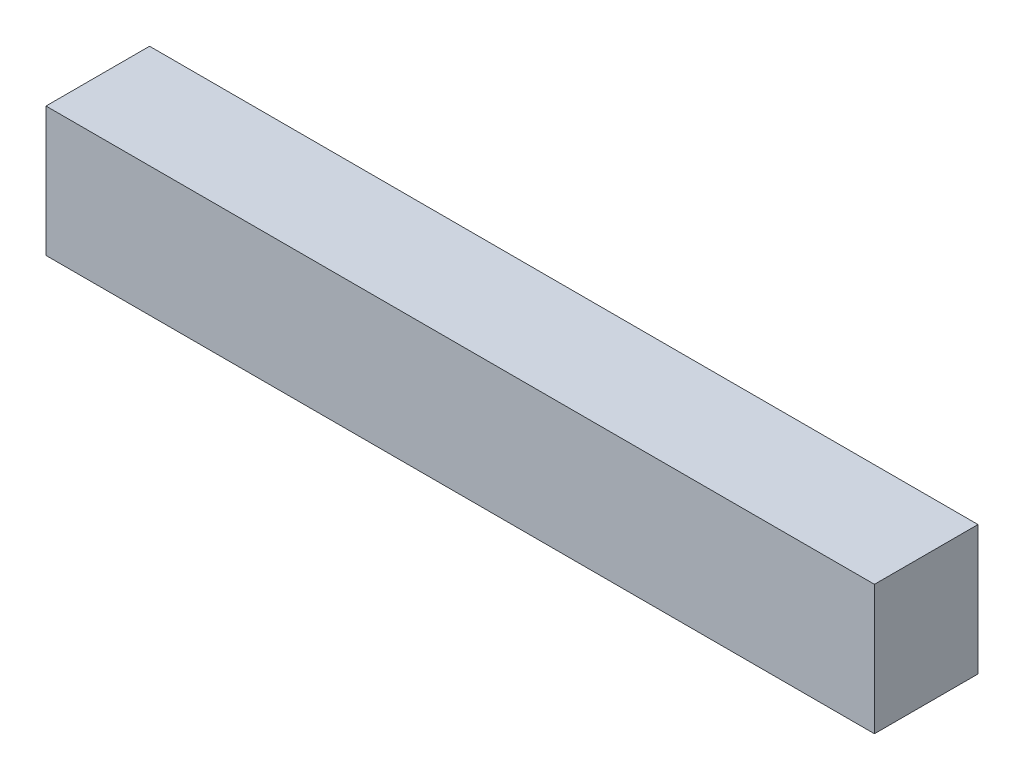
from build123d import *

# Parameters (mm, degrees)
SKETCH1_W           = 32
SKETCH1_H           = 4
BOSS_EXTRUDE1_DEPTH = 5


with BuildPart() as part:
    # Sketch1 → Boss-Extrude1 (new body)
    with BuildSketch(Plane(origin=(0, 0, 0), x_dir=(1, 0, 0), z_dir=(0, 1, 0))):
        Rectangle(SKETCH1_W, SKETCH1_H)
    extrude(amount=BOSS_EXTRUDE1_DEPTH)


solid = part.part
